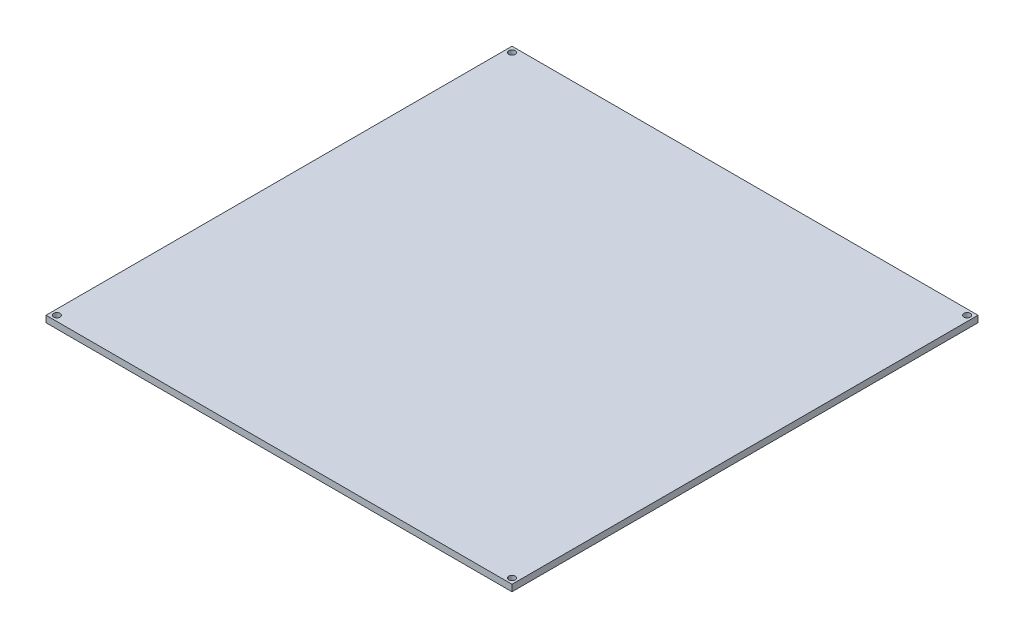
from build123d import *

# Parameters (mm, degrees)
SKETCH1_W           = 214
SKETCH1_H           = 214
SKETCH1_R           = 1.5
BOSS_EXTRUDE1_DEPTH = 3


with BuildPart() as part:
    # Sketch1 → Boss-Extrude1 (new body)
    with BuildSketch(Plane(origin=(0, 0, 0), x_dir=(1, 0, 0), z_dir=(0, 1, 0))):
        Rectangle(SKETCH1_W, SKETCH1_H)
        with Locations(Location((-104.5, 104.5, 0), (0, 0, 270))):
            Circle(SKETCH1_R, mode=Mode.SUBTRACT)
        with Locations(Location((104.5, 104.5, 0), (0, 0, 270))):
            Circle(SKETCH1_R, mode=Mode.SUBTRACT)
        with Locations(Location((104.5, -104.5, 0), (0, 0, 270))):
            Circle(SKETCH1_R, mode=Mode.SUBTRACT)
        with Locations(Location((-104.5, -104.5, 0), (0, 0, 270))):
            Circle(SKETCH1_R, mode=Mode.SUBTRACT)
    extrude(amount=BOSS_EXTRUDE1_DEPTH)


solid = part.part
